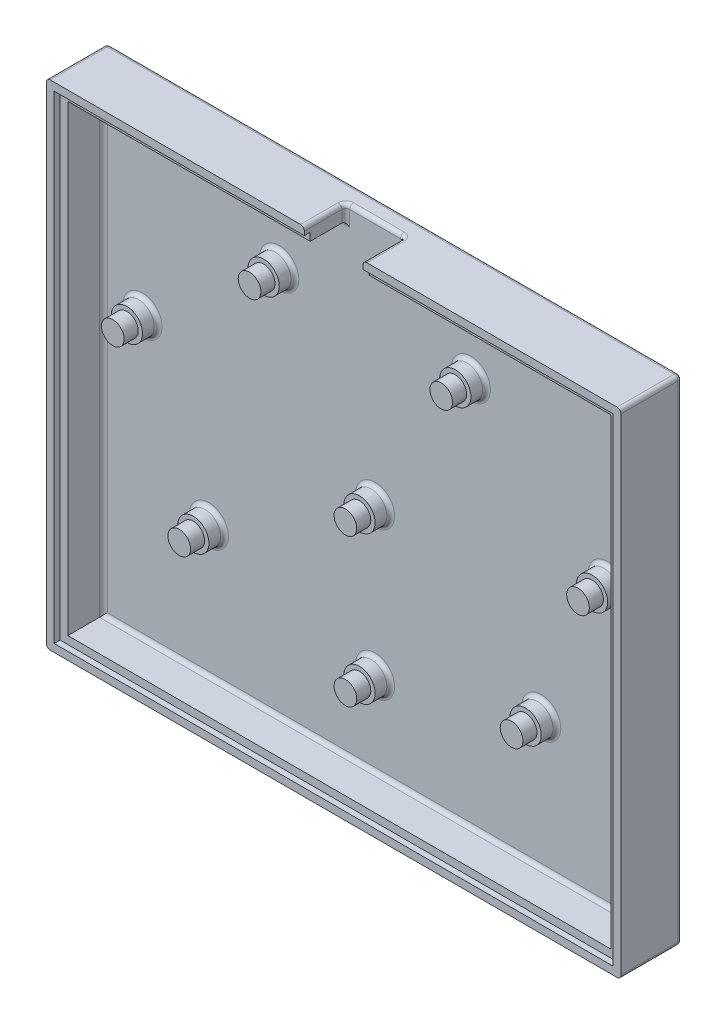
from build123d import *

# Parameters (mm, degrees)
CROQUIS1_W                 = 147.05
CROQUIS1_H                 = 126.4
SALIENTE_EXTRUIR1_DEPTH    = 5
CROQUIS2_W                 = 147.05
CROQUIS2_H                 = 126.4
CROQUIS2_W_2               = 139.05
CROQUIS2_H_2               = 118.4
SALIENTE_EXTRUIR2_DEPTH    = 10.6
CROQUIS3_W                 = 15
CROQUIS3_H                 = 10.6
CORTAR_EXTRUIR1_DEPTH      = 4
CROQUIS4_R                 = 4
SALIENTE_EXTRUIR4_DEPTH    = 4
CROQUIS5_R                 = 2.9
SALIENTE_EXTRUIR5_DEPTH    = 3.6
CORTAR_EXTRUIR2_DEPTH      = 1.5
REDONDEO2_R                = 1
S_LIDO_MOVER_COPIAR1_ANGLE = 90
REDONDEO3_R                = 1
REDONDEO4_R                = 1


with BuildPart() as part:
    # Croquis1 → Saliente-Extruir1 (new body)
    with BuildSketch(Plane(origin=(0, 0, 0), x_dir=(1, 0, 0), z_dir=(0, 1, 0))):
        with Locations((73.525, 63.2)):
            Rectangle(CROQUIS1_W, CROQUIS1_H)
    extrude(amount=SALIENTE_EXTRUIR1_DEPTH)

    # Croquis2 → Saliente-Extruir2 (add)
    with BuildSketch(Plane(origin=(0, 5, 0), x_dir=(1, 0, 0), z_dir=(0, 1, 0))):
        with Locations((73.525, 63.2)):
            Rectangle(CROQUIS2_W, CROQUIS2_H)
        with Locations((73.525, 63.2)):
            Rectangle(CROQUIS2_W_2, CROQUIS2_H_2, mode=Mode.SUBTRACT)
    extrude(amount=SALIENTE_EXTRUIR2_DEPTH)

    # Croquis3 → Cortar-Extruir1 (cut)
    with BuildSketch(Plane(origin=(0, 0, -126.4), x_dir=(-1, 0, 0), z_dir=(0, 0, -1))):
        with Locations((-73.525, 10.3)):
            Rectangle(CROQUIS3_W, CROQUIS3_H)
    extrude(amount=-CORTAR_EXTRUIR1_DEPTH, mode=Mode.SUBTRACT)

    # Croquis4 → Saliente-Extruir4 (add)
    with BuildSketch(Plane(origin=(0, 5, 0), x_dir=(1, 0, 0), z_dir=(0, 1, 0))):
        with Locations(Location((14, 75.4, 0), (0, 0, 90))):
            Circle(CROQUIS4_R)
        with Locations(Location((49, 103.4, 0), (0, 0, 90))):
            Circle(CROQUIS4_R)
        with Locations(Location((31, 37.4, 0), (0, 0, 90))):
            Circle(CROQUIS4_R)
        with Locations(Location((116.05, 37.4, 0), (0, 0, 90))):
            Circle(CROQUIS4_R)
        with Locations(Location((133.05, 75.4, 0), (0, 0, 90))):
            Circle(CROQUIS4_R)
        with Locations(Location((98.05, 103.4, 0), (0, 0, 90))):
            Circle(CROQUIS4_R)
        with Locations(Location((73.525, 63.2, 0), (0, 0, 90))):
            Circle(CROQUIS4_R)
        with Locations(Location((73.525, 25.4, 0), (0, 0, 90))):
            Circle(CROQUIS4_R)
    extrude(amount=SALIENTE_EXTRUIR4_DEPTH)

    # Croquis5 → Saliente-Extruir5 (add)
    with BuildSketch(Plane(origin=(0, 9, 0), x_dir=(1, 0, 0), z_dir=(0, 1, 0))):
        with Locations(Location((14, 75.4, 0), (0, 0, 270))):
            Circle(CROQUIS5_R)
        with Locations(Location((49, 103.4, 0), (0, 0, 270))):
            Circle(CROQUIS5_R)
        with Locations(Location((98.05, 103.4, 0), (0, 0, 270))):
            Circle(CROQUIS5_R)
        with Locations(Location((73.525, 63.2, 0), (0, 0, 270))):
            Circle(CROQUIS5_R)
        with Locations(Location((31, 37.4, 0), (0, 0, 270))):
            Circle(CROQUIS5_R)
        with Locations(Location((116.05, 37.4, 0), (0, 0, 270))):
            Circle(CROQUIS5_R)
        with Locations(Location((133.05, 75.4, 0), (0, 0, 270))):
            Circle(CROQUIS5_R)
        with Locations(Location((73.525, 25.4, 0), (0, 0, 270))):
            Circle(CROQUIS5_R)
    extrude(amount=SALIENTE_EXTRUIR5_DEPTH)

    # Croquis6 → Cortar-Extruir2 (cut)
    with BuildSketch(Plane(origin=(0, 15.6, 0), x_dir=(1, 0, 0), z_dir=(0, 1, 0))):
        Polygon((66.025, 124.4), (81.025, 124.4), (145.05, 124.4), (145.05, 2), (2, 2), (2, 124.4), align=None)
    extrude(amount=-CORTAR_EXTRUIR2_DEPTH, mode=Mode.SUBTRACT)

    # Redondeo2
    redondeo2_edges = [part.edges().sort_by_distance(p)[0] for p in [
        (0, 7.8, -126.4),
        (147.05, 7.8, -126.4),
        (147.05, 7.8, 0),
        (0, 7.8, 0),
    ]]
    fillet(redondeo2_edges, radius=REDONDEO2_R)


with BuildPart() as part_1:
    # Sólido-Mover/Copiar1: moved
    add(part.part.rotate(Axis((0, 7.8, -62.2), (1, 0, 0)), S_LIDO_MOVER_COPIAR1_ANGLE))

    # Redondeo3
    redondeo3_edges = [part_1.edges().sort_by_distance(p)[0] for p in [
        (73.525, 72, -70),
        (0, 8.8, -70),
        (147.05, 8.8, -70),
        (73.525, -54.4, -70),
        (0.292893219, -54.107106781, -70),
        (146.757106781, -54.107106781, -70),
        (0.292893219, 71.707106781, -70),
        (146.757106781, 71.707106781, -70),
    ]]
    fillet(redondeo3_edges, radius=REDONDEO3_R)

    # Redondeo4
    redondeo4_edges = [part_1.edges().sort_by_distance(p)[0] for p in [
        (112.0375, 68, -65),
        (4, 8.8, -65),
        (73.525, -50.4, -65),
        (143.05, 8.8, -65),
        (35.0125, 68, -65),
        (81.025, 72, -59.7),
        (73.525, 72, -65),
        (66.025, 72, -59.7),
        (66.025, 70, -65),
        (81.025, 70, -65),
        (14, 17, -65),
        (49, 45, -65),
        (31, -21, -65),
        (73.525, -33, -65),
        (116.05, -21, -65),
        (133.05, 17, -65),
        (98.05, 45, -65),
        (73.525, 4.8, -65),
    ]]
    fillet(redondeo4_edges, radius=REDONDEO4_R)


solid = part_1.part
